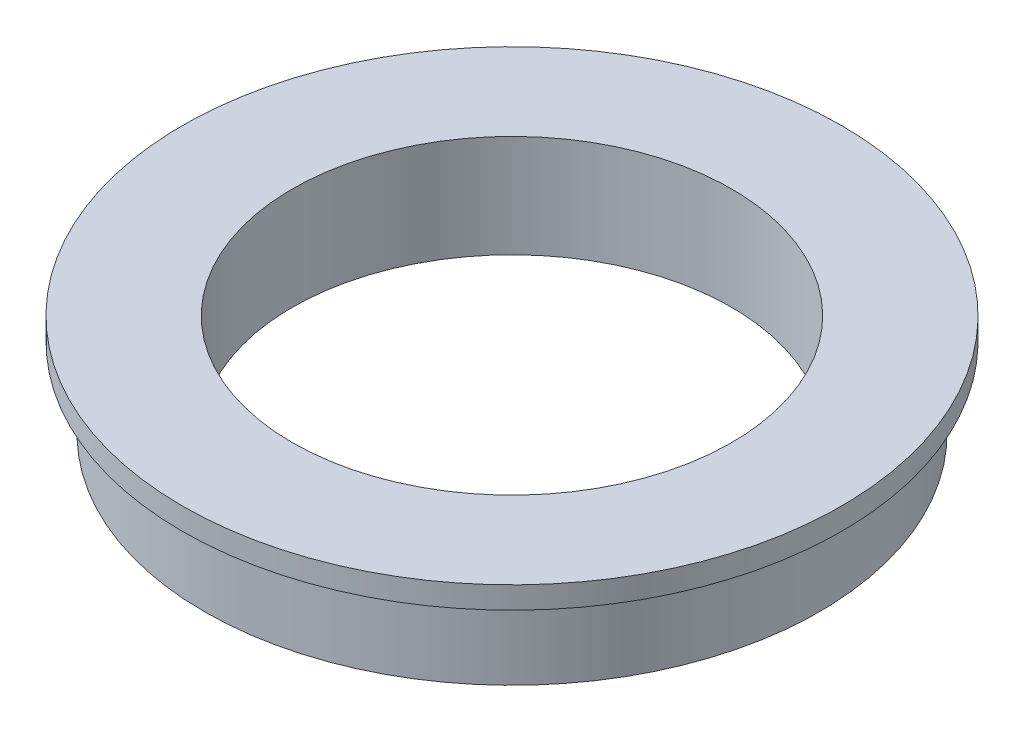
from build123d import *

# Parameters (mm, degrees)
SKETCH_1_R      = 21
SKETCH_1_R_2    = 15
EXTRUDE_1_DEPTH = 5.5
SKETCH_2_R      = 22.5
SKETCH_2_R_2    = 15
EXTRUDE_2_DEPTH = 1.5


with BuildPart() as part:
    # 草图1 → 凸台-拉伸1 (new body)
    with BuildSketch(Plane(origin=(0, 0, 0), x_dir=(1, 0, 0), z_dir=(0, 1, 0))):
        with Locations(Location((0, 0, 0), (0, 0, 270))):
            Circle(SKETCH_1_R)
        with Locations(Location((0, 0, 0), (0, 0, 270))):
            Circle(SKETCH_1_R_2, mode=Mode.SUBTRACT)
    extrude(amount=EXTRUDE_1_DEPTH)

    # 草图2 → 凸台-拉伸2 (add)
    with BuildSketch(Plane(origin=(0, 5.5, 0), x_dir=(1, 0, 0), z_dir=(0, 1, 0))):
        with Locations(Location((0, 0, 0), (0, 0, 270))):
            Circle(SKETCH_2_R)
        with Locations(Location((0, 0, 0), (0, 0, 270))):
            Circle(SKETCH_2_R_2, mode=Mode.SUBTRACT)
    extrude(amount=EXTRUDE_2_DEPTH)


solid = part.part
